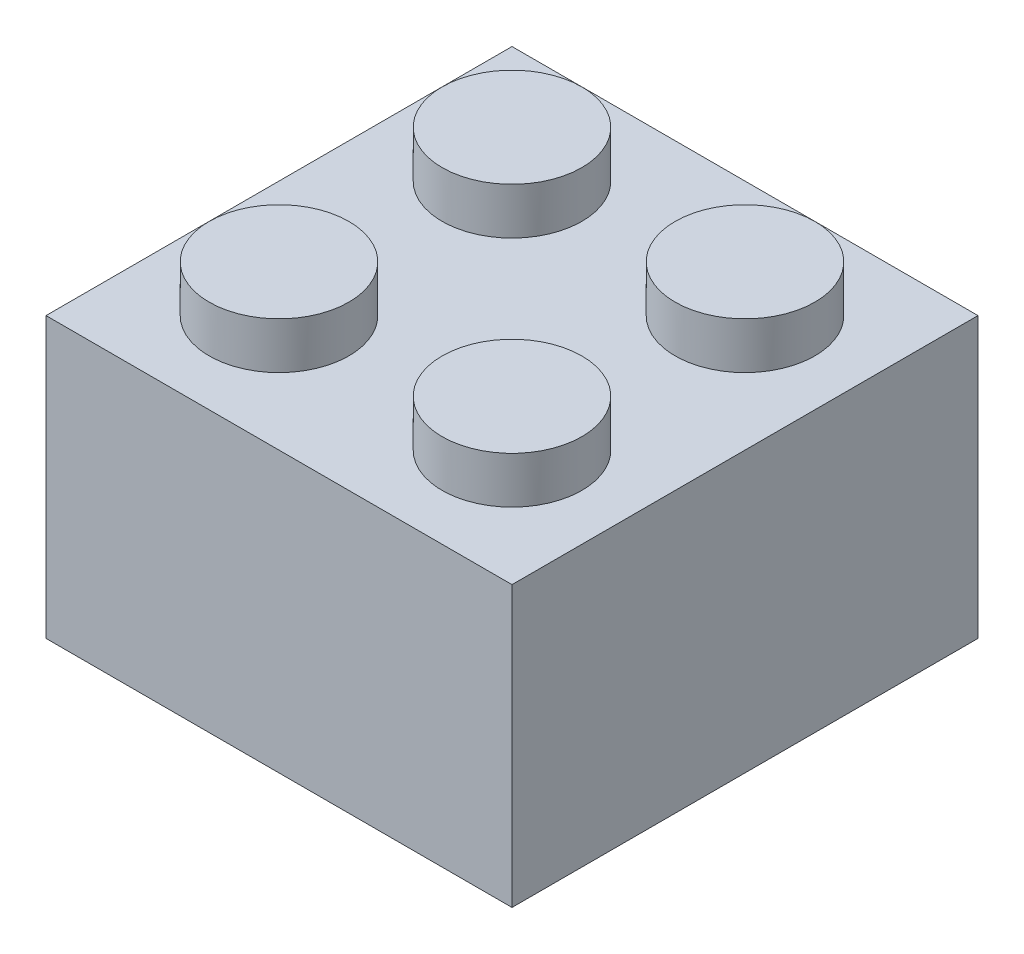
from build123d import *

# Parameters (mm, degrees)
SKETCH1_W            = 16
SKETCH1_H            = 16
BOSS_EXTRUDE1_DEPTH  = 9.6
SKETCH2_R            = 2.4
BOSS_EXTRUDE2_DEPTH  = 1.6
LPATTERN1_COUNT      = 2
LPATTERN1_PITCH      = 8
LPATTERN1_COUNT_DIR2 = 4
LPATTERN1_PITCH_DIR2 = 8
SHELL1_T             = -1.6


with BuildPart() as part:
    # Sketch1 → Boss-Extrude1 (new body)
    with BuildSketch(Plane(origin=(0, 0, 0), x_dir=(1, 0, 0), z_dir=(0, 1, 0))):
        with Locations((8, 8)):
            Rectangle(SKETCH1_W, SKETCH1_H)
    extrude(amount=BOSS_EXTRUDE1_DEPTH)

    # Sketch2 → Boss-Extrude2 (add)
    with BuildSketch(Plane(origin=(0, 9.6, 0), x_dir=(1, 0, 0), z_dir=(0, 1, 0))):
        with Locations(Location((12, 4, 0), (0, 0, 90))):
            Circle(SKETCH2_R)
    boss_extrude2 = extrude(amount=BOSS_EXTRUDE2_DEPTH)

    # LPattern1: Boss-Extrude2 2 × 4, 4 skipped
    with Locations(*[(-i * LPATTERN1_PITCH, 0, -j * LPATTERN1_PITCH_DIR2) for i in range(LPATTERN1_COUNT) for j in range(LPATTERN1_COUNT_DIR2) if (i, j) not in ((0, 0), (0, 2), (0, 3), (1, 2), (1, 3))]):
        add(boss_extrude2)

    # Shell1
    shell1_openings = [part.faces().sort_by_distance(p)[0] for p in [
        (8, 0, -8),
    ]]
    offset(amount=SHELL1_T, openings=shell1_openings, kind=Kind.INTERSECTION)


solid = part.part
